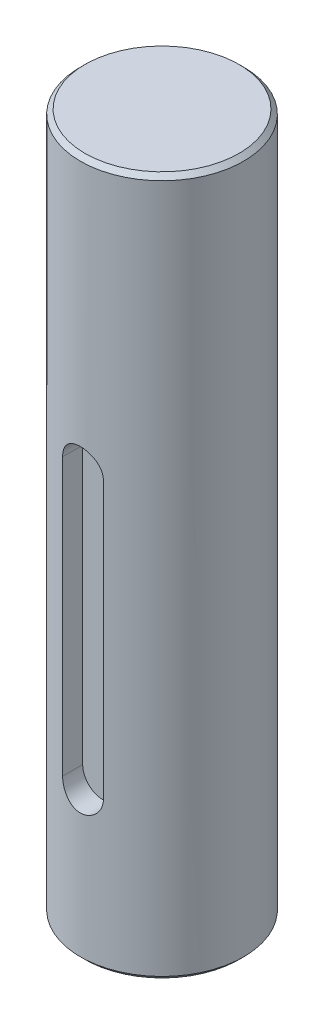
from build123d import *

# Parameters (mm, degrees)
ESQUISSE1_W                  = 18
ESQUISSE1_H                  = 154
ENL_V_MAT_EXTRU_1_REACH      = 160.117
ENL_V_MAT_EXTRU_1_END_RADIUS = 18
CHANFREIN1_SIZE              = 1
CHANFREIN2_SIZE              = 1


with BuildPart() as part:
    # Esquisse1 → Révolution1 (revolve)
    with BuildSketch(Plane.XY, mode=Mode.PRIVATE) as r_volution1_sk:
        with Locations((9, 77)):
            Rectangle(ESQUISSE1_W, ESQUISSE1_H)
    revolve(r_volution1_sk.sketch.rotate(Axis((0, 154, 0), (0, -1, 0)), 270), axis=Axis((0, 154, 0), (0, -1, 0)))

    # Enlèv. mat.-Extru.1: up to this cylinder (the profile starts inside it)
    enl_v_mat_extru_1_end = Plane(origin=(0, 63.5, 0), z_dir=(0, -1, 0)) * Cylinder(ENL_V_MAT_EXTRU_1_END_RADIUS, 357.234, mode=Mode.PRIVATE)
    # Esquisse2 → Enlèv. mat.-Extru.1 (cut, up to the surface)
    with BuildSketch(Plane(origin=(0, 0, 13), x_dir=(-1, 0, 0), z_dir=(0, 0, -1)), mode=Mode.PRIVATE) as enl_v_mat_extru_1_sk1:
        with BuildLine():
            Line((-4.5, 94), (-4.5, 33))
            ThreePointArc((-4.5, 33), (0, 28.5), (4.5, 33))
            Line((4.5, 33), (4.5, 94))
            ThreePointArc((4.5, 94), (0, 98.5), (-4.5, 94))
        make_face()
    enl_v_mat_extru_1_tool1 = extrude(enl_v_mat_extru_1_sk1.sketch, amount=-ENL_V_MAT_EXTRU_1_REACH, mode=Mode.PRIVATE) & enl_v_mat_extru_1_end
    add(enl_v_mat_extru_1_tool1.solids().sort_by_distance((0, 63.5, 13))[0], mode=Mode.SUBTRACT)

    # Chanfrein1
    chanfrein1_edges = [part.edges().sort_by_distance(p)[0] for p in [
        (0, 154, 18),
    ]]
    chamfer(chanfrein1_edges, length=CHANFREIN1_SIZE)

    # Chanfrein2
    chanfrein2_edges = [part.edges().sort_by_distance(p)[0] for p in [
        (0, 0, 18),
    ]]
    chamfer(chanfrein2_edges, length=CHANFREIN2_SIZE)


solid = part.part
